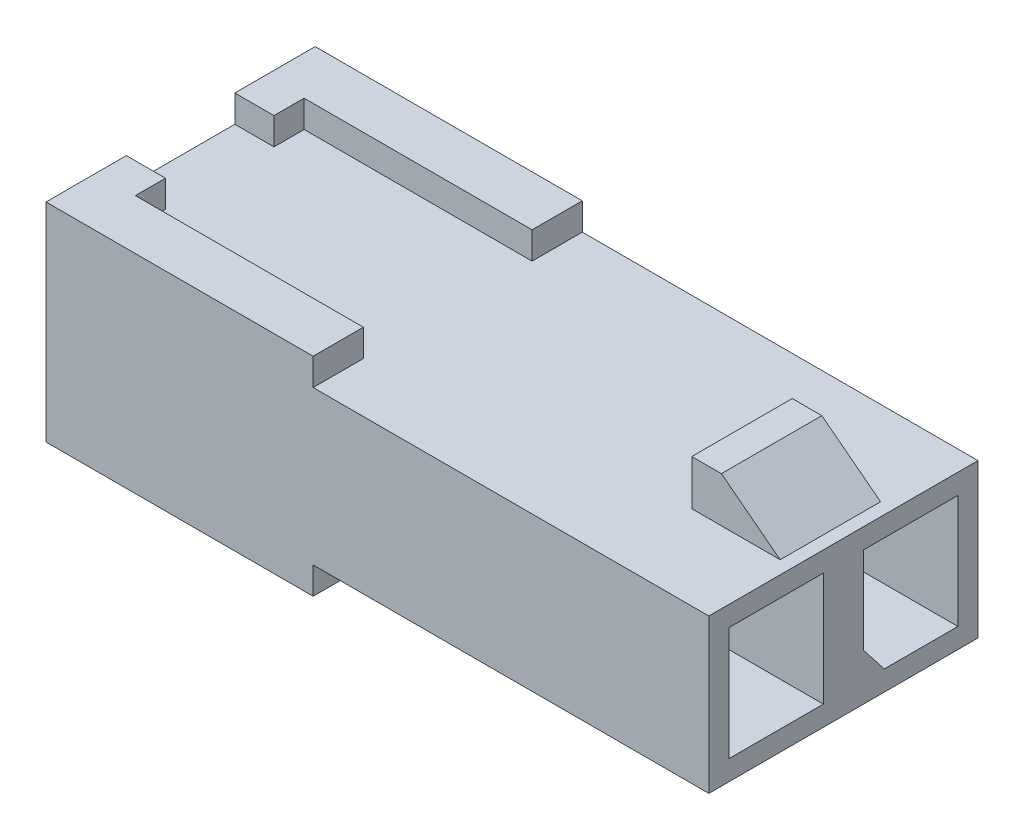
from build123d import *

# Parameters (mm, degrees)
SKETCH1_W      = 3.4036
SKETCH1_H      = 3.8862
EXTRUDE1_DEPTH = 16.764
EXTRUDE2_DEPTH = 0.6858
EXTRUDE3_DEPTH = 0.6858
EXTRUDE4_DEPTH = 1.27
SKETCH5_W      = 2.3876
SKETCH5_H      = 2.8702
EXTRUDE5_DEPTH = 9.906
SKETCH6_W      = 2.54
SKETCH6_H      = 2.54
EXTRUDE6_DEPTH = 6.35
EXTRUDE7_DEPTH = 9.906


with BuildPart() as part:
    # Sketch1 → Extrude1 (new body)
    with BuildSketch(Plane(origin=(0, 0, 0), x_dir=(0, 0, -1), z_dir=(1, 0, 0))):
        with Locations((-1.7018, 0)):
            Rectangle(SKETCH1_W, SKETCH1_H)
    extrude1 = extrude(amount=EXTRUDE1_DEPTH)

    # Sketch2 → Extrude2 (add)
    with BuildSketch(Plane(origin=(0, 1.9431, 0), x_dir=(1, 0, 0), z_dir=(0, 1, 0))):
        Polygon((0, -3.4036), (6.7564, -3.4036), (6.7564, -2.1336), (0.9906, -2.1336), (0.9906, -1.3716), (0, -1.3716), align=None)
    extrude2 = extrude(amount=EXTRUDE2_DEPTH)

    # Sketch3 → Extrude3 (add)
    with BuildSketch(Plane.XZ.offset(1.9431)):
        Polygon((0, 3.4036), (6.7564, 3.4036), (6.7564, 2.1336), (0.9906, 2.1336), (0.9906, 0), (0, 0), align=None)
    extrude3 = extrude(amount=EXTRUDE3_DEPTH)

    # Sketch4 → Extrude4 (add)
    with BuildSketch(Plane.XY):
        Polygon((16.4338, 1.9431), (14.9479, 3.0861), (14.1986, 3.0861), (14.1986, 1.9431), align=None)
    extrude4 = extrude(amount=EXTRUDE4_DEPTH)

    # Sketch5 → Extrude5 (cut)
    with BuildSketch(Plane(origin=(16.764, 0, 0), x_dir=(0, 0, -1), z_dir=(1, 0, 0))):
        with Locations((-1.7018, 0)):
            Rectangle(SKETCH5_W, SKETCH5_H)
    extrude5 = extrude(amount=-EXTRUDE5_DEPTH, mode=Mode.SUBTRACT)

    # Sketch6 → Extrude6 (cut)
    with BuildSketch(Plane.ZY):
        with Locations((1.4732, -0.0635)):
            Rectangle(SKETCH6_W, SKETCH6_H)
    extrude6 = extrude(amount=-EXTRUDE6_DEPTH, mode=Mode.SUBTRACT)

    # Mirror1: Extrude1, Extrude2, Extrude3, Extrude4, Extrude5, Extrude6 across Front Plane
    add(extrude1.mirror(Plane.XY))
    add(extrude2.mirror(Plane.XY))
    add(extrude3.mirror(Plane.XY))
    add(extrude4.mirror(Plane.XY))
    add(extrude5.mirror(Plane.XY), mode=Mode.SUBTRACT)
    add(extrude6.mirror(Plane.XY), mode=Mode.SUBTRACT)

    # Sketch7 → Extrude7 (add)
    with BuildSketch(Plane(origin=(6.858, 0, 0), x_dir=(0, 0, -1), z_dir=(1, 0, 0))):
        Polygon((0.508, -0.762663848), (1.033234934, -1.4351), (0.508, -1.4351), align=None)
    extrude(amount=EXTRUDE7_DEPTH)


solid = part.part
